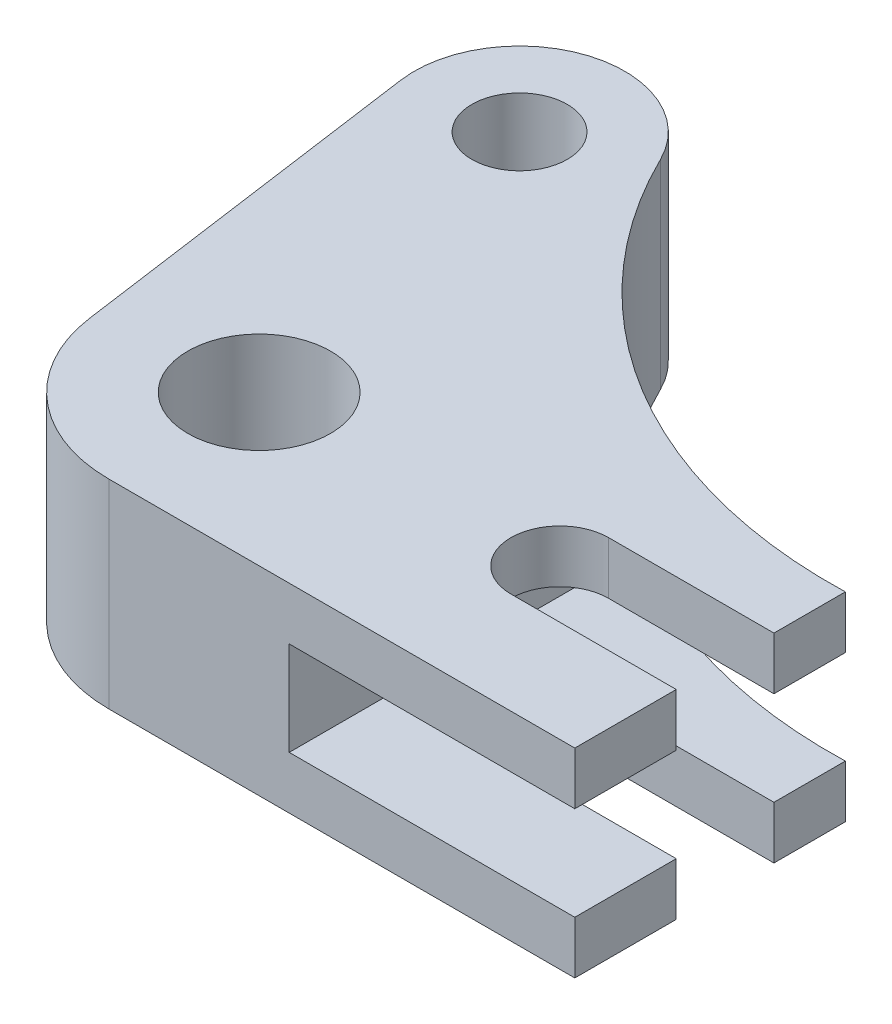
from build123d import *

# Parameters (mm, degrees)
SKETCH1_R           = 9.5
SKETCH1_R_2         = 6.35
BOSS_EXTRUDE1_DEPTH = 13.25
SKETCH2_W           = 73.338944958
SKETCH2_H           = 12.5
CUT_EXTRUDE3_DEPTH  = 38


with BuildPart() as part:
    # Sketch1 → Boss-Extrude1 (new, symmetric)
    with BuildSketch(Plane(origin=(0, 0, 0), x_dir=(1, 0, 0), z_dir=(0, 1, 0))):
        with BuildLine():
            Line((0, 0), (-62, 0))
            ThreePointArc((-62, 0), (-75.125587601, 4.90964049), (-81.806983567, 17.228104986))
            Line((-81.806983567, 17.228104986), (-88.547021707, 65.390038979))
            ThreePointArc((-88.547021707, 65.390038979), (-78.78369233, 80.716074763), (-62.110282709, 73.49060696))
            ThreePointArc((-62.110282709, 73.49060696), (-36.56849942, 45.611382856), (0, 36))
            Line((0, 36), (0, 26.5))
            Line((0, 26.5), (-22, 26.5))
            ThreePointArc((-22, 26.5), (-28.5, 20), (-22, 13.5))
            Line((-22, 13.5), (0, 13.5))
            Line((0, 13.5), (0, 0))
        make_face()
        with Locations(Location((-62, 20, 0), (0, 0, 270))):
            Circle(SKETCH1_R, mode=Mode.SUBTRACT)
        with Locations(Location((-74.68213321, 67.330365488, 0), (0, 0, 270))):
            Circle(SKETCH1_R_2, mode=Mode.SUBTRACT)
    extrude(amount=BOSS_EXTRUDE1_DEPTH, both=True)

    # Sketch2 → Cut-Extrude3 (cut)
    with BuildSketch(Plane(origin=(0, 0, 0), x_dir=(0, 0, -1), z_dir=(1, 0, 0))):
        with Locations((36.669472479, 0)):
            Rectangle(SKETCH2_W, SKETCH2_H)
    extrude(amount=-CUT_EXTRUDE3_DEPTH, mode=Mode.SUBTRACT)


solid = part.part
